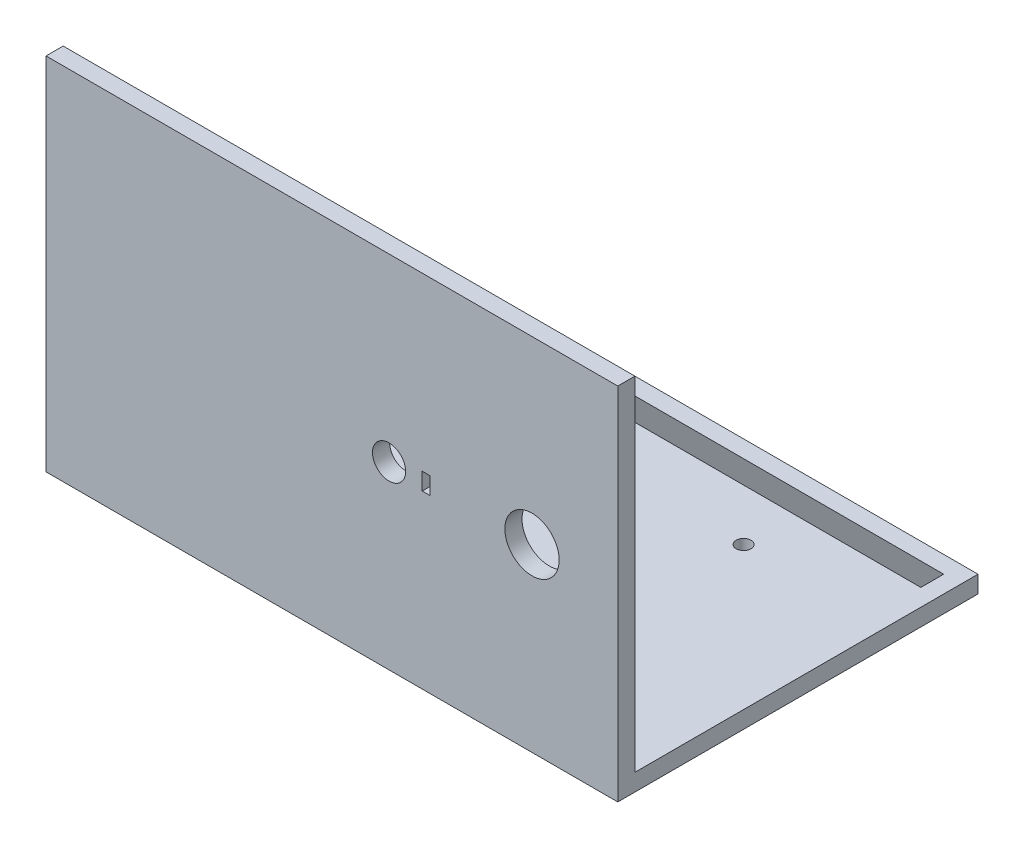
from build123d import *

# Parameters (mm, degrees)
SKETCH1_W                    = 127
SKETCH1_H                    = 80.01
BASE_DEPTH                   = 3.81
SKETCH2_W                    = 127
SKETCH2_H                    = 3.81
FRONT_PANELING_DEPTH         = 76.2
SKETCH4_R                    = 1.651
ARDUINO_MOUNTING_HOLES_DEPTH = 107.95368168
STABILITY_STRUT_DEPTH        = 3.81
SKETCH5_R                    = 6.0325
ON_OFF_SWITCH_RECESS_DEPTH   = 130.751494018
SKETCH7_R                    = 3.683
SKETCH7_W                    = 1.778
SKETCH7_H                    = 3.81
POTENTIOMETER_RECESS_DEPTH   = 3.81


with BuildPart() as part:
    # Sketch1 → Base (new body)
    with BuildSketch(Plane(origin=(0, 0, 0), x_dir=(1, 0, 0), z_dir=(0, 1, 0))):
        Rectangle(SKETCH1_W, SKETCH1_H)
    extrude(amount=BASE_DEPTH)

    # Sketch2 → Front Paneling (add)
    with BuildSketch(Plane(origin=(0, 3.81, 0), x_dir=(1, 0, 0), z_dir=(0, 1, 0))):
        with Locations((0, -38.1)):
            Rectangle(SKETCH2_W, SKETCH2_H)
    extrude(amount=FRONT_PANELING_DEPTH)

    # Sketch4 → Arduino Mounting Holes (cut, through all)
    with BuildSketch(Plane(origin=(0, 3.81, 0), x_dir=(1, 0, 0), z_dir=(0, 1, 0))):
        with Locations(Location((-44.45, -28.575, 0), (0, 0, 270))):
            Circle(SKETCH4_R)
        with Locations(Location((-43.18, 19.685, 0), (0, 0, 270))):
            Circle(SKETCH4_R)
        with Locations(Location((31.75, 19.685, 0), (0, 0, 270))):
            Circle(SKETCH4_R)
        with Locations(Location((38.1, -28.575, 0), (0, 0, 270))):
            Circle(SKETCH4_R)
    extrude(amount=-ARDUINO_MOUNTING_HOLES_DEPTH, mode=Mode.SUBTRACT)

    # Sketch3 → Stability Strut (add)
    with BuildSketch(Plane.ZY.offset(55.88)):
        Polygon((36.195, 76.2), (-36.195, 3.81), (-31.115, 3.81), (36.195, 71.12), align=None)
    stability_strut = extrude(amount=STABILITY_STRUT_DEPTH)

    # Mirror Strut: Stability Strut across plane
    add(stability_strut.mirror(Plane(origin=(0, 0, 0), x_dir=(0, 0, 1), z_dir=(1, 0, 0))))

    # Sketch5 → On Off Switch Recess (cut, through all)
    with BuildSketch(Plane.XY.offset(40.005)):
        with Locations((44.45, 40.005)):
            Circle(SKETCH5_R)
    extrude(amount=-ON_OFF_SWITCH_RECESS_DEPTH, mode=Mode.SUBTRACT)

    # Sketch7 → Potentiometer Recess (cut)
    with BuildSketch(Plane.XY.offset(40.005)):
        with Locations((12.7, 40.005)):
            Circle(SKETCH7_R)
        with Locations((20.955, 40.005)):
            Rectangle(SKETCH7_W, SKETCH7_H)
    extrude(amount=-POTENTIOMETER_RECESS_DEPTH, mode=Mode.SUBTRACT)


solid = part.part
